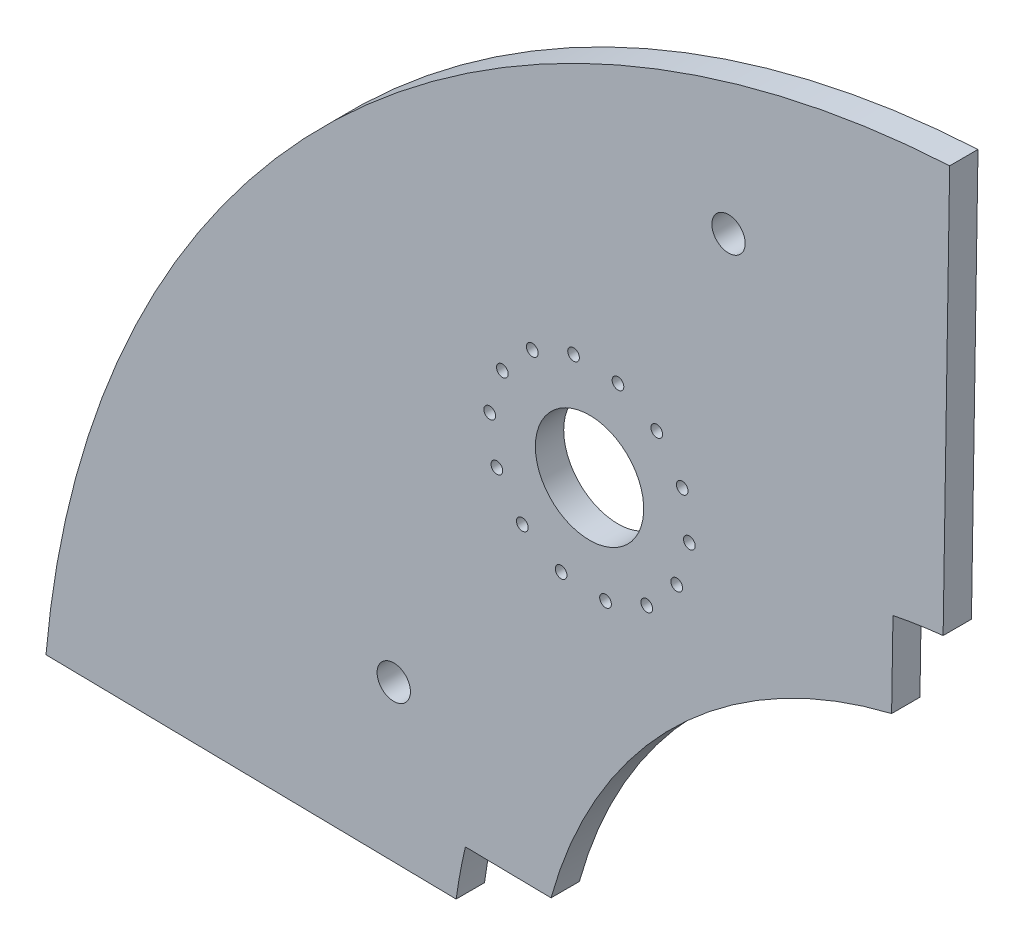
from build123d import *

# Parameters (mm, degrees)
SKETCH1_R               = 0.35
SKETCH1_R_2             = 3.25
BOSS_EXTRUDE1_DEPTH     = 1.7
CUT_EXTRUDE7_DEPTH      = 98.489717815
CUT_EXTRUDE7_DEPTH_BACK = 8
SKETCH8_R               = 1


with BuildPart() as part:
    # Sketch1 → Boss-Extrude1 (new body)
    with BuildSketch(Plane(origin=(0, 0, 0), x_dir=(0.9998727759206639, -0.01595092388251767, 0), z_dir=(0, 0, 1))):
        with BuildLine():
            Line((-2.997717637, 37.06709755), (-2.997717637, 32.530879478))
            Line((-2.997717637, 32.530879478), (-2.997717637, 31.928949981))
            ThreePointArc((-2.997717637, 31.928949981), (-15.796707511, 24.61705643), (-23.108601061, 11.818066557))
            Line((-23.108601061, 11.818066557), (-23.710530558, 11.818066557))
            Line((-23.710530558, 11.818066557), (-28.246748631, 11.818066557))
            ThreePointArc((-28.246748631, 11.818066557), (-28.535166423, 10.323920401), (-28.754396346, 8.818066557))
            Line((-28.754396346, 8.818066557), (-53.35841847, 8.818066557))
            ThreePointArc((-53.35841847, 8.818066557), (-36.656357556, 45.476706475), (0.002282363, 62.17876739))
            Line((0.002282363, 62.17876739), (0.002282363, 37.574745265))
            ThreePointArc((0.002282363, 37.574745265), (-1.503571481, 37.355515342), (-2.997717637, 37.06709755))
        make_face()
        with Locations(Location((-19.551610928, 40.614103035, 0), (0, 0, 180.913959377))):
            Circle(SKETCH1_R, mode=Mode.SUBTRACT)
        with Locations(Location((-17.204071523, 39.341585745, 0), (0, 0, 180.913959377))):
            Circle(SKETCH1_R, mode=Mode.SUBTRACT)
        with Locations(Location((-15.641136163, 37.176528108, 0), (0, 0, 180.913959377))):
            Circle(SKETCH1_R, mode=Mode.SUBTRACT)
        with Locations(Location((-15.172363365, 34.547746341, 0), (0, 0, 180.913959377))):
            Circle(SKETCH1_R, mode=Mode.SUBTRACT)
        with Locations(Location((-15.890599329, 31.975902915, 0), (0, 0, 180.913959377))):
            Circle(SKETCH1_R, mode=Mode.SUBTRACT)
        with Locations(Location((-17.653588615, 29.97038296, 0), (0, 0, 180.913959377))):
            Circle(SKETCH1_R, mode=Mode.SUBTRACT)
        with Locations(Location((-20.112149573, 28.928404301, 0), (0, 0, 180.913959377))):
            Circle(SKETCH1_R, mode=Mode.SUBTRACT)
        with Locations(Location((-22.779334053, 29.056343589, 0), (0, 0, 180.913959377))):
            Circle(SKETCH1_R, mode=Mode.SUBTRACT)
        with Locations(Location((-25.126873458, 30.328860879, 0), (0, 0, 180.913959377))):
            Circle(SKETCH1_R, mode=Mode.SUBTRACT)
        with Locations(Location((-26.689808818, 32.493918517, 0), (0, 0, 180.913959377))):
            Circle(SKETCH1_R, mode=Mode.SUBTRACT)
        with Locations(Location((-27.158581616, 35.122700283, 0), (0, 0, 180.913959377))):
            Circle(SKETCH1_R, mode=Mode.SUBTRACT)
        with Locations(Location((-26.440345652, 37.694543709, 0), (0, 0, 180.913959377))):
            Circle(SKETCH1_R, mode=Mode.SUBTRACT)
        with Locations(Location((-24.677356366, 39.700063664, 0), (0, 0, 180.913959377))):
            Circle(SKETCH1_R, mode=Mode.SUBTRACT)
        with Locations(Location((-22.218795408, 40.742042323, 0), (0, 0, 180.913959377))):
            Circle(SKETCH1_R, mode=Mode.SUBTRACT)
        with Locations(Location((-21.165472491, 34.835223312, 0), (0, 0, 180.913959377))):
            Circle(SKETCH1_R_2, mode=Mode.SUBTRACT)
    extrude(amount=BOSS_EXTRUDE1_DEPTH)

    # Sketch8 → Cut-Extrude7 (cut, two sides: drawn at the far end of the back side and taken through both)
    with BuildSketch(Plane(origin=(0, 0, -51.287040458), x_dir=(0.9998727759206648, -0.015950923882458373, 0), z_dir=(0, 0, 1)).offset(-CUT_EXTRUDE7_DEPTH_BACK)):
        with Locations(Location((-13.098724804, 51.802697596, 0), (0, 0, 0.913959377))):
            Circle(SKETCH8_R)
        with Locations(Location((-32.645729848, 18.156852147, 0), (0, 0, 0.913959377))):
            Circle(SKETCH8_R)
    extrude(amount=CUT_EXTRUDE7_DEPTH + CUT_EXTRUDE7_DEPTH_BACK, mode=Mode.SUBTRACT)


solid = part.part
